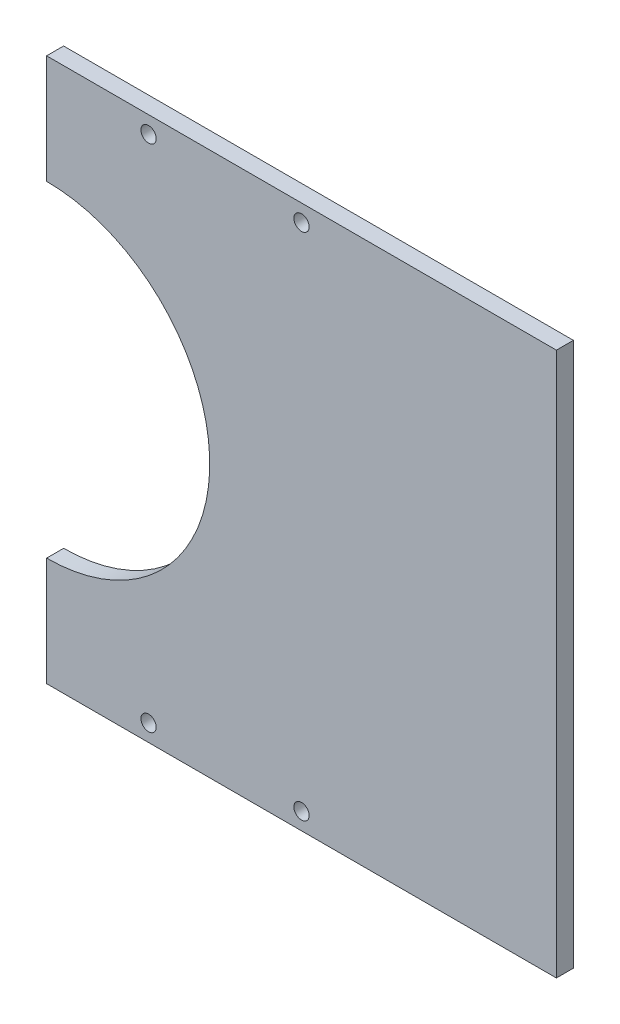
from build123d import *

# Parameters (mm, degrees)
BOSS_EXTRUDE1_DEPTH     = 5
CUT_EXTRUDE1_DEPTH      = 110.772492001
CUT_EXTRUDE1_DEPTH_BACK = 110.772492001
SKETCH2_R               = 2.25


with BuildPart() as part:
    # Sketch1 → Boss-Extrude1 (new body)
    with BuildSketch(Plane(origin=(0, 0, 0), x_dir=(0, 1, 0), z_dir=(0, 0, 1))):
        with BuildLine():
            Line((-48, 75), (-80, 75))
            Line((-80, 75), (-80, -75))
            Line((-80, -75), (80, -75))
            Line((80, -75), (80, 75))
            Line((80, 75), (48, 75))
            ThreePointArc((48, 75), (0, 27), (-48, 75))
        make_face()
    extrude(amount=BOSS_EXTRUDE1_DEPTH)

    # Sketch2 → Cut-Extrude1 (cut, two sides: drawn at the far end of the back side and taken through both)
    with BuildSketch(Plane.XY.offset(5).offset(-CUT_EXTRUDE1_DEPTH_BACK)):
        with Locations((0, -75)):
            Circle(SKETCH2_R)
        with Locations((-45, -75)):
            Circle(SKETCH2_R)
        with Locations((0, 75)):
            Circle(SKETCH2_R)
        with Locations((-45, 75)):
            Circle(SKETCH2_R)
    extrude(amount=CUT_EXTRUDE1_DEPTH + CUT_EXTRUDE1_DEPTH_BACK, mode=Mode.SUBTRACT)


solid = part.part
